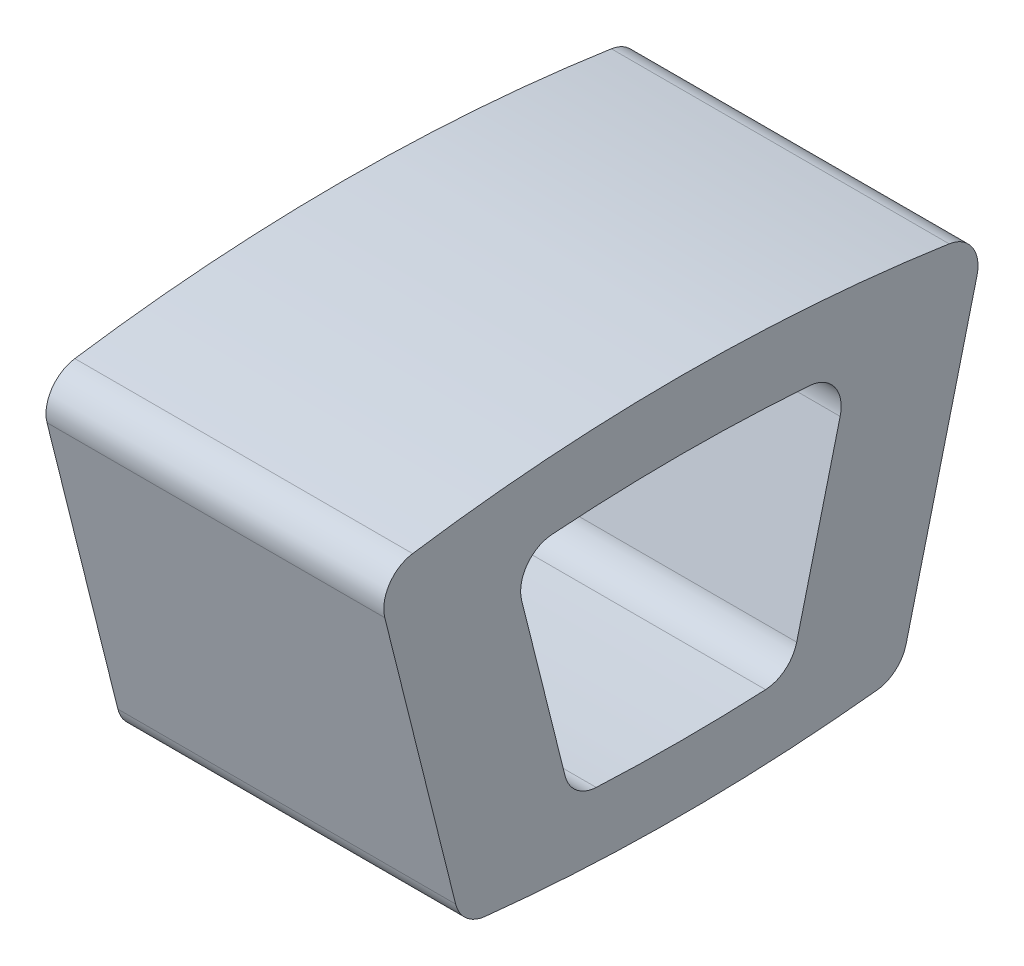
from build123d import *

# Parameters (mm, degrees)
EXTRUDE_1_DEPTH = 40


with BuildPart() as part:
    # Эскиз1 → Вытянуть1 (new body)
    with BuildSketch(Plane(origin=(0, 0, 0), x_dir=(0, 0, -1), z_dir=(1, 0, 0))):
        with BuildLine():
            Line((26.672393858, 176.18957543), (35.064656469, 209.758625876))
            ThreePointArc((35.064656469, 209.758625876), (34.509070686, 212.952387038), (31.769638193, 214.68567742))
            ThreePointArc((31.769638193, 214.68567742), (0, 217.023616226), (-31.769638193, 214.68567742))
            ThreePointArc((-31.769638193, 214.68567742), (-34.509070686, 212.952387038), (-35.064656469, 209.758625876))
            Line((-35.064656469, 209.758625876), (-26.672393858, 176.18957543))
            ThreePointArc((-26.672393858, 176.18957543), (-25.418843537, 174.143301579), (-23.219791878, 173.182678407))
            ThreePointArc((-23.219791878, 173.182678407), (0, 171.936937008), (23.219791878, 173.182678407))
            ThreePointArc((23.219791878, 173.182678407), (25.418843537, 174.143301579), (26.672393858, 176.18957543))
        make_face()
        with BuildLine():
            Line((13.715292518, 182.861170071), (18.86026165, 203.441046598))
            ThreePointArc((18.86026165, 203.441046598), (18.220421187, 206.755900608), (15.272036319, 208.400491618))
            ThreePointArc((15.272036319, 208.400491618), (0, 208.959326186), (-15.272036319, 208.400491618))
            ThreePointArc((-15.272036319, 208.400491618), (-18.220421187, 206.755900608), (-18.86026165, 203.441046598))
            Line((-18.86026165, 203.441046598), (-13.715292518, 182.861170071))
            ThreePointArc((-13.715292518, 182.861170071), (-12.371326308, 180.738475491), (-10.026657624, 179.835920111))
            ThreePointArc((-10.026657624, 179.835920111), (0, 179.595223033), (10.026657624, 179.835920111))
            ThreePointArc((10.026657624, 179.835920111), (12.371326308, 180.738475491), (13.715292518, 182.861170071))
        make_face(mode=Mode.SUBTRACT)
    extrude(amount=EXTRUDE_1_DEPTH)


solid = part.part
